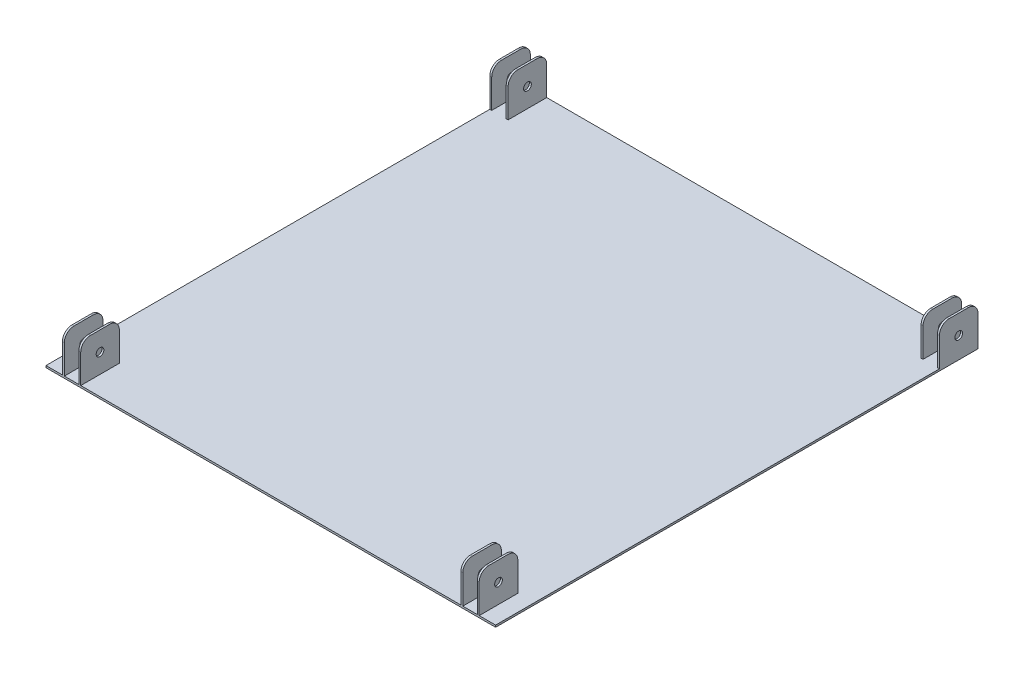
from build123d import *

# Parameters (mm, degrees)
SKETCH1_W               = 466
SKETCH1_H               = 500
BOSS_EXTRUDE1_DEPTH     = 2
SKETCH2_W               = 2
SKETCH2_H               = 40
BOSS_EXTRUDE2_DEPTH     = 40
FILLET1_R               = 10
SKETCH3_R               = 4
CUT_EXTRUDE1_DEPTH      = 531.490339215
CROQUIS2_W              = 40
CROQUIS2_H              = 40
CORTAR_EXTRUIR1_DEPTH   = 10
CROQUIS3_W              = 40
CROQUIS3_H              = 40
CORTAR_EXTRUIR2_DEPTH   = 10
CROQUIS4_W              = 2
CROQUIS4_H              = 40
SALIENTE_EXTRUIR1_DEPTH = 40
CROQUIS5_R              = 4
CORTAR_EXTRUIR3_DEPTH   = 516.620984833
REDONDEO1_R             = 10


with BuildPart() as part:
    # Sketch1 → Boss-Extrude1 (new body)
    with BuildSketch(Plane(origin=(0, 0, 0), x_dir=(1, 0, 0), z_dir=(0, 1, 0))):
        Rectangle(SKETCH1_W, SKETCH1_H)
    extrude(amount=BOSS_EXTRUDE1_DEPTH)

    # Sketch2 → Boss-Extrude2 (add)
    with BuildSketch(Plane(origin=(0, 2, 0), x_dir=(1, 0, 0), z_dir=(0, 1, 0))):
        with Locations((232, -230)):
            Rectangle(SKETCH2_W, SKETCH2_H)
        with Locations((232, 230)):
            Rectangle(SKETCH2_W, SKETCH2_H)
        with Locations((-232, 230)):
            Rectangle(SKETCH2_W, SKETCH2_H)
        with Locations((-232, -230)):
            Rectangle(SKETCH2_W, SKETCH2_H)
        with Locations((215, -230)):
            Rectangle(SKETCH2_W, SKETCH2_H)
        with Locations((-215, -230)):
            Rectangle(SKETCH2_W, SKETCH2_H)
        with Locations((-215, 230)):
            Rectangle(SKETCH2_W, SKETCH2_H)
        with Locations((215, 230)):
            Rectangle(SKETCH2_W, SKETCH2_H)
    extrude(amount=BOSS_EXTRUDE2_DEPTH)

    # Fillet1
    fillet1_edges = [part.edges().sort_by_distance(p)[0] for p in [
        (-232, 42, 250),
        (232, 42, -250),
        (215, 42, -250),
        (232, 42, -210),
        (215, 42, -210),
        (-215, 42, -250),
        (-232, 42, -250),
        (-215, 42, -210),
        (-232, 42, -210),
        (232, 42, 210),
        (215, 42, 210),
        (232, 42, 250),
        (215, 42, 250),
        (-215, 42, 250),
        (-215, 42, 210),
        (-232, 42, 210),
    ]]
    fillet(fillet1_edges, radius=FILLET1_R)

    # Sketch3 → Cut-Extrude1 (cut, through all)
    with BuildSketch(Plane.ZY.offset(233)):
        with Locations((-230, 22)):
            Circle(SKETCH3_R)
        with Locations((230, 22)):
            Circle(SKETCH3_R)
    extrude(amount=-CUT_EXTRUDE1_DEPTH, mode=Mode.SUBTRACT)

    # Croquis2 → Cortar-Extruir1 (cut)
    with BuildSketch(Plane.ZY.offset(233)):
        with Locations((230, 22)):
            Rectangle(CROQUIS2_W, CROQUIS2_H)
    extrude(amount=-CORTAR_EXTRUIR1_DEPTH, mode=Mode.SUBTRACT)

    # Croquis3 → Cortar-Extruir2 (cut)
    with BuildSketch(Plane(origin=(233, 0, 0), x_dir=(0, 0, -1), z_dir=(1, 0, 0))):
        with Locations((-230, 22)):
            Rectangle(CROQUIS3_W, CROQUIS3_H)
    extrude(amount=-CORTAR_EXTRUIR2_DEPTH, mode=Mode.SUBTRACT)

    # Croquis4 → Saliente-Extruir1 (add)
    with BuildSketch(Plane(origin=(0, 2, 0), x_dir=(1, 0, 0), z_dir=(0, 1, 0))):
        with Locations((-198, -230)):
            Rectangle(CROQUIS4_W, CROQUIS4_H)
        with Locations((198, -230)):
            Rectangle(CROQUIS4_W, CROQUIS4_H)
    extrude(amount=SALIENTE_EXTRUIR1_DEPTH)

    # Croquis5 → Cortar-Extruir3 (cut, through all)
    with BuildSketch(Plane.ZY.offset(216)):
        with Locations((230, 22)):
            Circle(CROQUIS5_R)
    extrude(amount=-CORTAR_EXTRUIR3_DEPTH, mode=Mode.SUBTRACT)

    # Redondeo1
    redondeo1_edges = [part.edges().sort_by_distance(p)[0] for p in [
        (198, 42, 210),
        (198, 42, 250),
        (-198, 42, 210),
        (-198, 42, 250),
    ]]
    fillet(redondeo1_edges, radius=REDONDEO1_R)


solid = part.part
